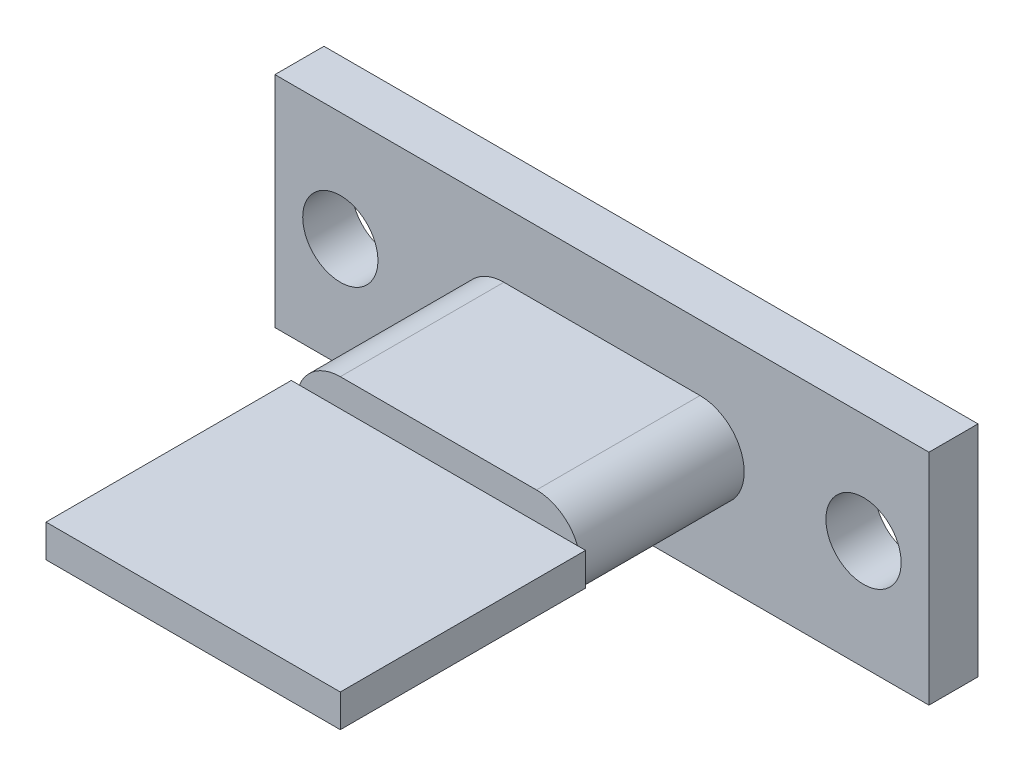
from build123d import *

# Parameters (mm, degrees)
SKETCH1_W           = 20
SKETCH1_H           = 6.7
BOSS_EXTRUDE1_DEPTH = 1.5
SKETCH2_R           = 1.15
CUT_EXTRUDE1_DEPTH  = 1.5
BOSS_EXTRUDE2_DEPTH = 5
BOSS_EXTRUDE3_START = -1
BOSS_EXTRUDE3_DEPTH = 1
SKETCH5_W           = 6
SKETCH5_H           = 0.6
BOSS_EXTRUDE4_DEPTH = 4.5
SKETCH6_W           = 9
SKETCH6_H           = 1
BOSS_EXTRUDE5_DEPTH = 7.5


with BuildPart() as part:
    # Sketch1 → Boss-Extrude1 (new body)
    with BuildSketch(Plane.XY):
        Rectangle(SKETCH1_W, SKETCH1_H)
    extrude(amount=BOSS_EXTRUDE1_DEPTH)

    # Sketch2 → Cut-Extrude1 (cut)
    with BuildSketch(Plane(origin=(0, 0, 0), x_dir=(-1, 0, 0), z_dir=(0, 0, -1))):
        with Locations((-8, 0)):
            Circle(SKETCH2_R)
        with Locations((8, 0)):
            Circle(SKETCH2_R)
        with BuildLine():
            Line((-3, 1.25), (3, 1.25))
            ThreePointArc((3, 1.25), (4.25, 0), (3, -1.25))
            Line((3, -1.25), (-3, -1.25))
            ThreePointArc((-3, -1.25), (-4.25, 0), (-3, 1.25))
        make_face()
    extrude(amount=-CUT_EXTRUDE1_DEPTH, mode=Mode.SUBTRACT)

    # Sketch3 → Boss-Extrude2 (add)
    with BuildSketch(Plane.XY.offset(1.5)):
        with BuildLine():
            Line((3, 1.35), (-3, 1.35))
            ThreePointArc((-3, 1.35), (-4.35, 0), (-3, -1.35))
            Line((-3, -1.35), (3, -1.35))
            ThreePointArc((3, -1.35), (4.35, 0), (3, 1.35))
        make_face()
        with BuildLine():
            Line((3, 1.25), (-3, 1.25))
            ThreePointArc((-3, 1.25), (-4.25, 0), (-3, -1.25))
            Line((-3, -1.25), (3, -1.25))
            ThreePointArc((3, -1.25), (4.25, 0), (3, 1.25))
        make_face(mode=Mode.SUBTRACT)
    extrude(amount=BOSS_EXTRUDE2_DEPTH)

    # Sketch4 → Boss-Extrude3 (add)
    with BuildSketch(Plane.XY.offset(6.5).offset(BOSS_EXTRUDE3_START)):
        with BuildLine():
            Line((3, 1.35), (-3, 1.35))
            ThreePointArc((-3, 1.35), (-4.35, 0), (-3, -1.35))
            Line((-3, -1.35), (3, -1.35))
            ThreePointArc((3, -1.35), (4.35, 0), (3, 1.35))
        make_face()
    extrude(amount=BOSS_EXTRUDE3_DEPTH)

    # Sketch5 → Boss-Extrude4 (add)
    with BuildSketch(Plane(origin=(0, 0, 5.5), x_dir=(-1, 0, 0), z_dir=(0, 0, -1))):
        Rectangle(SKETCH5_W, SKETCH5_H)
    extrude(amount=BOSS_EXTRUDE4_DEPTH)

    # Sketch6 → Boss-Extrude5 (add)
    with BuildSketch(Plane.XY.offset(6.5)):
        Rectangle(SKETCH6_W, SKETCH6_H)
    extrude(amount=BOSS_EXTRUDE5_DEPTH)


solid = part.part
